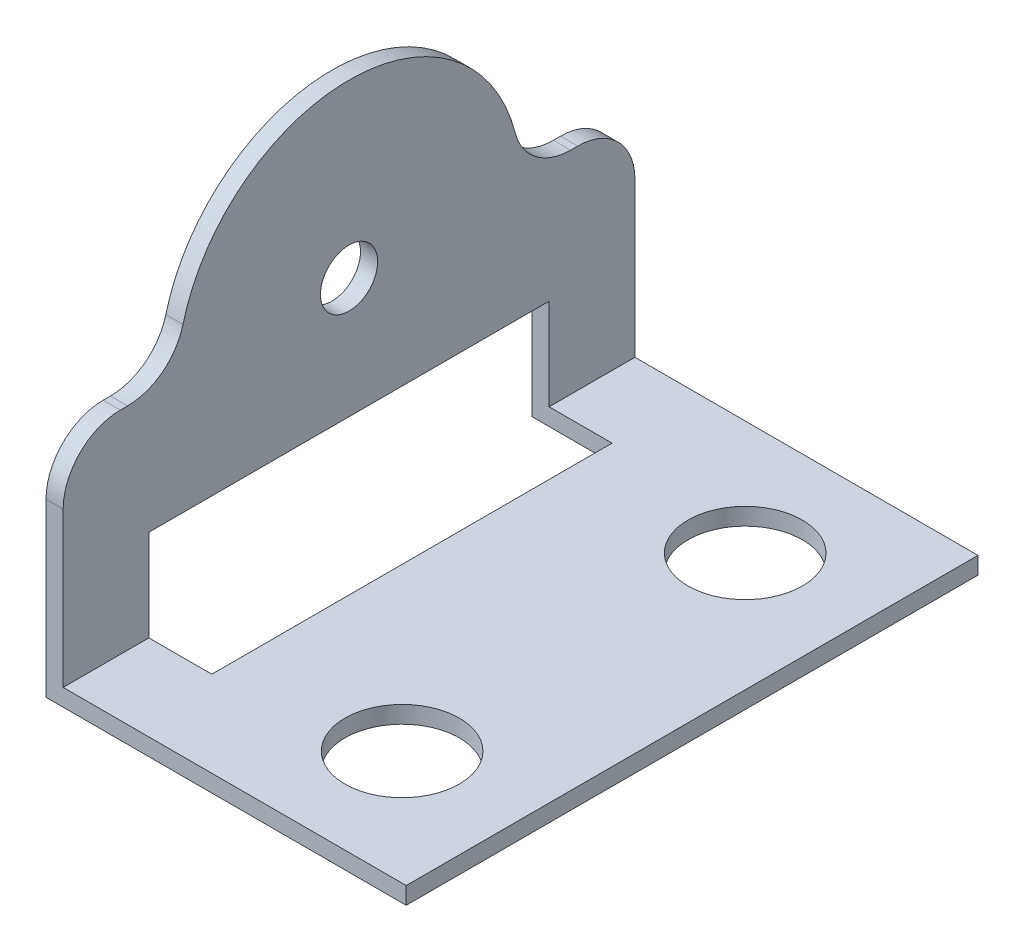
from build123d import *

# Parameters (mm, degrees)
SKETCH1_W           = 35
SKETCH1_H           = 8
SKETCH1_R           = 2.5
BOSS_EXTRUDE1_DEPTH = 1.5
BOSS_EXTRUDE2_DEPTH = 30
FILLET1_R           = 5
SKETCH2_R           = 5
SKETCH2_W           = 7
SKETCH2_H           = 35
CUT_EXTRUDE1_DEPTH  = 30


with BuildPart() as part:
    # Sketch1 → Boss-Extrude1 (new body)
    with BuildSketch(Plane(origin=(0, 0, 0), x_dir=(0, 0, -1), z_dir=(1, 0, 0))):
        with BuildLine():
            Line((25, 0), (15, 0))
            ThreePointArc((15, 0), (0, 15), (-15, 0))
            Line((-15, 0), (-25, 0))
            Line((-25, 0), (-25, -20))
            Line((-25, -20), (25, -20))
            Line((25, -20), (25, 0))
        make_face()
        with Locations((0, -14.5)):
            Rectangle(SKETCH1_W, SKETCH1_H, mode=Mode.SUBTRACT)
        Circle(SKETCH1_R, mode=Mode.SUBTRACT)
    extrude(amount=-BOSS_EXTRUDE1_DEPTH)

    # Sketch1<3> → Boss-Extrude2 (add)
    with BuildSketch(Plane(origin=(0, 0, 0), x_dir=(0, 0, -1), z_dir=(1, 0, 0))):
        Polygon((25, -20), (25, -18.5), (17.5, -18.5), (-17.5, -18.5), (-25, -18.5), (-25, -20), align=None)
    extrude(amount=BOSS_EXTRUDE2_DEPTH)

    # Fillet1
    fillet1_edges = [part.edges().sort_by_distance(p)[0] for p in [
        (-0.75, 0, -15),
        (-0.75, 0, 15),
        (-0.75, 0, -25),
        (-0.75, 0, 25),
    ]]
    fillet(fillet1_edges, radius=FILLET1_R)

    # Sketch2 → Cut-Extrude1 (cut)
    with BuildSketch(Plane(origin=(0, -18.5, 0), x_dir=(1, 0, 0), z_dir=(0, 1, 0))):
        with Locations((19.642277283, 15)):
            Circle(SKETCH2_R)
        with Locations((19.642277283, -15)):
            Circle(SKETCH2_R)
        with Locations((2, 0)):
            Rectangle(SKETCH2_W, SKETCH2_H)
    extrude(amount=-CUT_EXTRUDE1_DEPTH, mode=Mode.SUBTRACT)


solid = part.part
